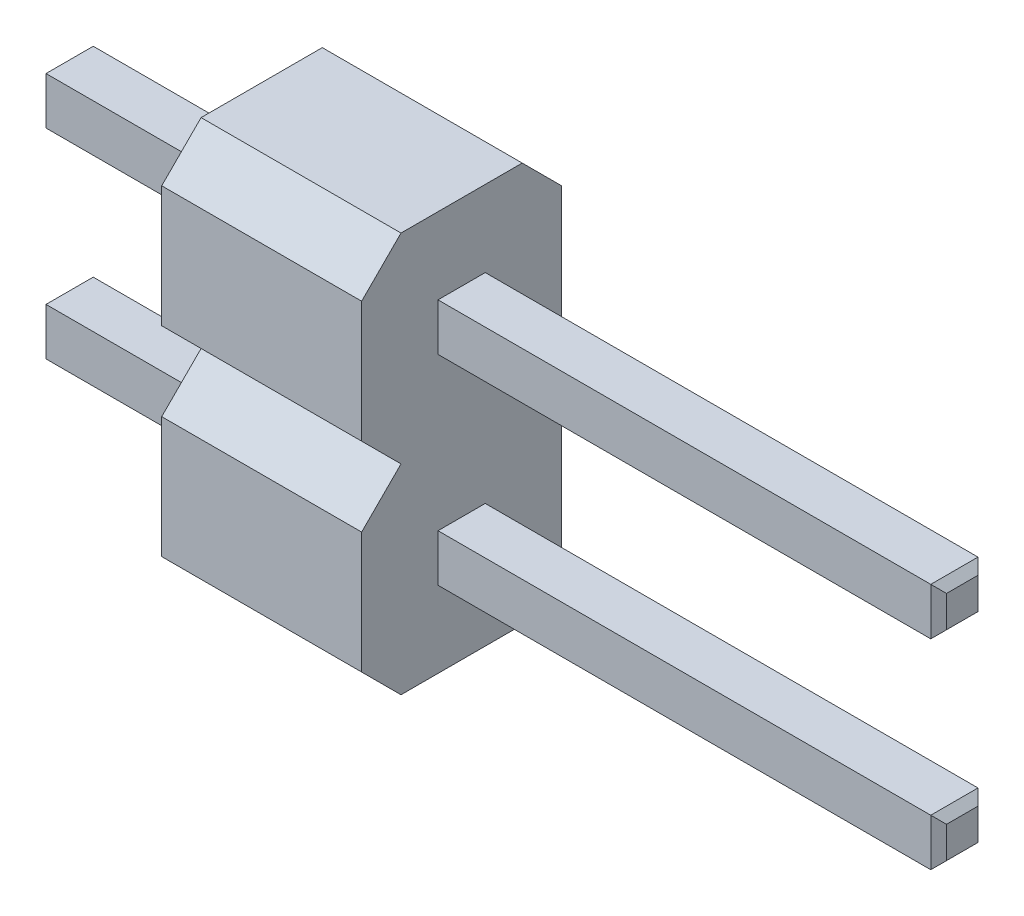
from build123d import *

# Parameters (mm, degrees)
PLASTIC_DEPTH   = 2.54
SKETCH2_W       = 11.44
SKETCH2_H       = 0.6
CONTACT_DEPTH   = 0.3
CHAMFER1_SIZE   = 0.1
LPATTERN1_COUNT = 2
LPATTERN1_PITCH = 2.54


with BuildPart() as part:
    # Sketch1 → Plastic (new body)
    with BuildSketch(Plane(origin=(0, 0, 0), x_dir=(0, 0, -1), z_dir=(1, 0, 0))):
        Polygon((-2.04, 1.27), (-0.5, 1.27), (0, 0.77), (0, -0.77), (-0.5, -1.27), (-2.04, -1.27), (-2.54, -0.77), (-2.54, 0.77), align=None)
    extrude(amount=PLASTIC_DEPTH)

    # Sketch2 → Contact (add, symmetric)
    with BuildSketch(Plane(origin=(0, 0, 0), x_dir=(1, 0, 0), z_dir=(0, 1, 0))):
        with Locations((3.18, -1.27)):
            Rectangle(SKETCH2_W, SKETCH2_H)
    extrude(amount=CONTACT_DEPTH, both=True)

    # Chamfer1
    chamfer1_edges = [part.edges().sort_by_distance(p)[0] for p in [
        (8.9, 0, 0.97),
        (8.9, 0.3, 1.27),
        (-2.54, 0, 1.57),
        (8.9, -0.3, 1.27),
        (8.9, 0, 1.57),
        (-2.54, -0.3, 1.27),
        (-2.54, 0, 0.97),
        (-2.54, 0.3, 1.27),
    ]]
    chamfer(chamfer1_edges, length=CHAMFER1_SIZE)

    # LPattern1: part ×2


with BuildPart() as part_1:
    add(part.part)
    with Locations(*[(0, i * LPATTERN1_PITCH, 0) for i in range(1, LPATTERN1_COUNT)]):
        add(part.part)


solid = part_1.part
